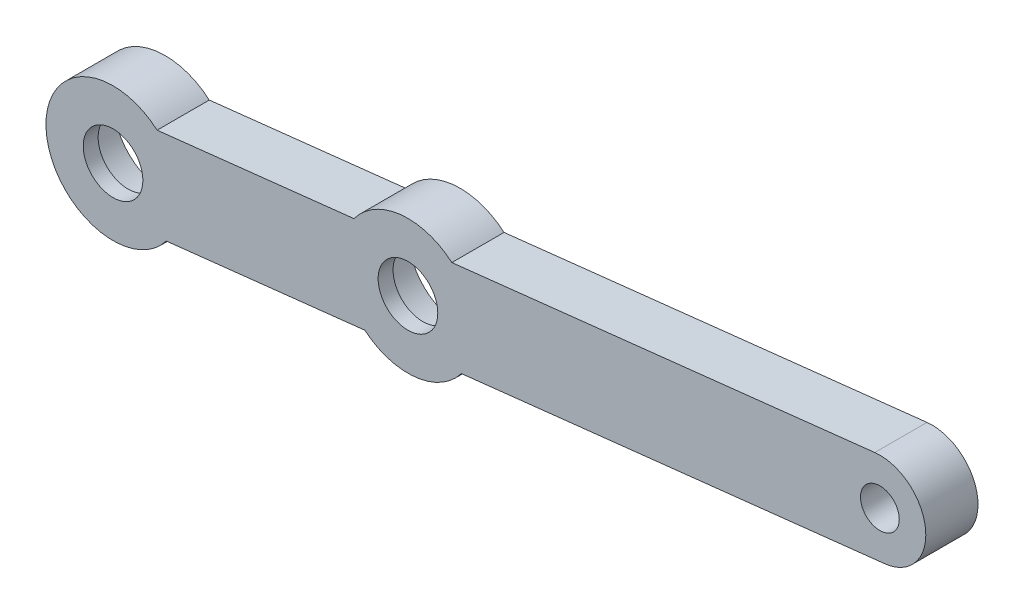
from build123d import *

# Parameters (mm, degrees)
SKETCH1_R           = 2.6
SKETCH1_R_2         = 6.9
BOSS_EXTRUDE1_DEPTH = 5
SKETCH2_R           = 2.6
SKETCH2_R_2         = 4
BOSS_EXTRUDE2_DEPTH = 2
SCALE1_SCALE        = 1.5


with BuildPart() as part:
    # Sketch1 → Boss-Extrude1 (new body)
    with BuildSketch(Plane.XY):
        with BuildLine():
            Line((-117.842377899, -77.068349263), (-91.221161774, -74.112086796))
            ThreePointArc((-91.221161774, -74.112086796), (-84.435913767, -76.1684327), (-78.267124508, -72.673552434))
            Line((-78.267124508, -72.673552434), (-21.451382857, -66.364214657))
            ThreePointArc((-21.451382857, -66.364214657), (-16.007105356, -59.559722092), (-22.811597922, -54.115444591))
            Line((-22.811597922, -54.115444591), (-79.542760834, -60.415389973))
            ThreePointArc((-79.542760834, -60.415389973), (-86.42258563, -58.278403776), (-92.665955577, -61.872709124))
            Line((-92.665955577, -61.872709124), (-119.079141177, -64.805869985))
            ThreePointArc((-119.079141177, -64.805869985), (-133.941604274, -72.498469269), (-117.842377899, -77.068349263))
        make_face()
        with Locations((-22.131490389, -60.239829624)):
            Circle(SKETCH1_R, mode=Mode.SUBTRACT)
        with Locations((-85.429249698, -67.223418238)):
            Circle(SKETCH1_R_2, mode=Mode.SUBTRACT)
        with Locations((-124.987033061, -71.595333402)):
            Circle(SKETCH1_R_2, mode=Mode.SUBTRACT)
    extrude(amount=BOSS_EXTRUDE1_DEPTH)

    # Sketch2 → Boss-Extrude2 (add)
    with BuildSketch(Plane.XY.offset(5)):
        with BuildLine():
            Line((-22.811597922, -54.115444591), (-79.542760834, -60.415389973))
            ThreePointArc((-79.542760834, -60.415389973), (-86.42258563, -58.278403776), (-92.665955577, -61.872709124))
            Line((-92.665955577, -61.872709124), (-119.079141177, -64.805869985))
            ThreePointArc((-119.079141177, -64.805869985), (-133.941604274, -72.498469269), (-117.842377899, -77.068349263))
            Line((-117.842377899, -77.068349263), (-91.221161774, -74.112086796))
            ThreePointArc((-91.221161774, -74.112086796), (-84.435913767, -76.1684327), (-78.267124508, -72.673552434))
            Line((-78.267124508, -72.673552434), (-21.451382857, -66.364214657))
            ThreePointArc((-21.451382857, -66.364214657), (-16.007105356, -59.559722092), (-22.811597922, -54.115444591))
        make_face()
        with Locations((-22.131490389, -60.239829624)):
            Circle(SKETCH2_R, mode=Mode.SUBTRACT)
        with Locations((-85.429249698, -67.223418238)):
            Circle(SKETCH2_R_2, mode=Mode.SUBTRACT)
        with Locations((-124.987033061, -71.595333402)):
            Circle(SKETCH2_R_2, mode=Mode.SUBTRACT)
    extrude(amount=BOSS_EXTRUDE2_DEPTH)


with BuildPart() as part_1:
    # Scale1: scaled about (-72.846730446, -65.862557014, 3.611202843)
    add(part.part.scale(SCALE1_SCALE).moved(Location((36.423365223, 32.931278507, -1.805601422))))


solid = part_1.part
